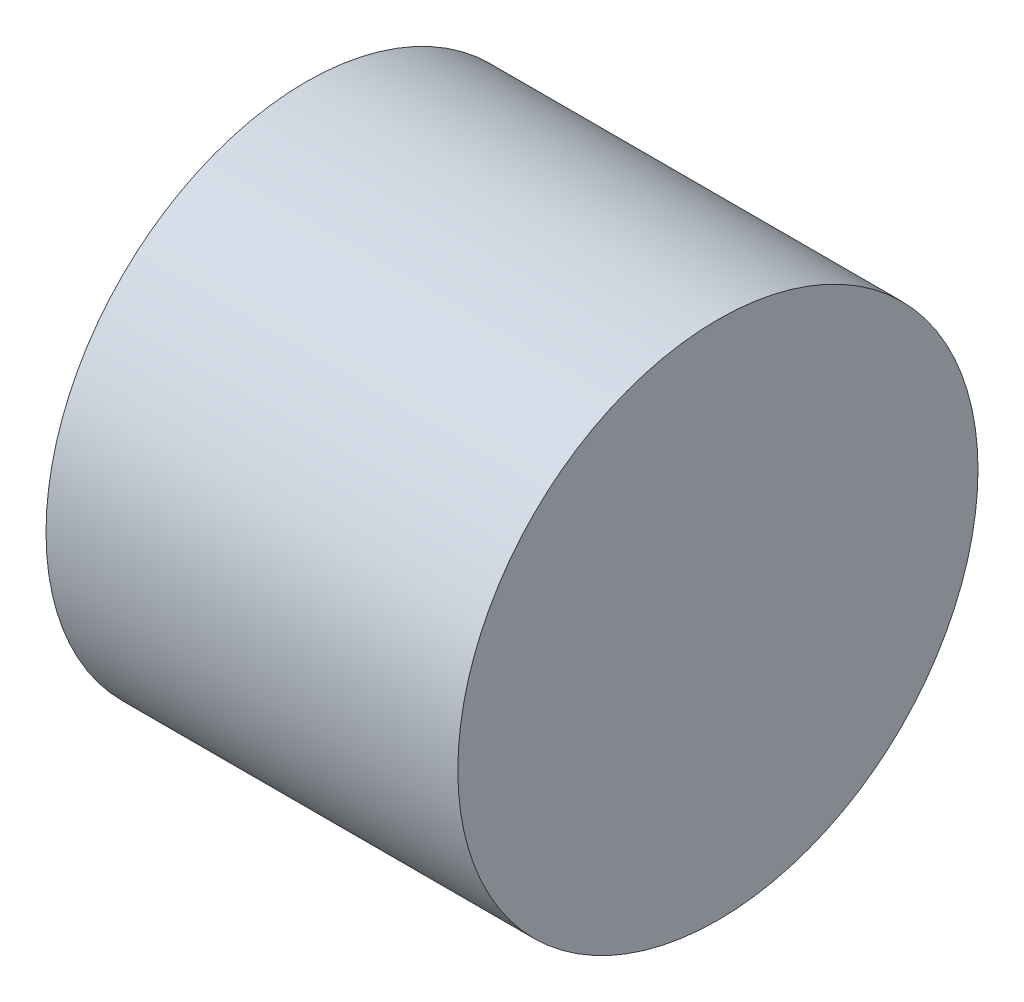
from build123d import *

# Parameters (mm, degrees)
BODY_SK1_R = 6
BODY_DEPTH = 9.5


with BuildPart() as part:
    # Body_Sk1 → Body (new body)
    with BuildSketch(Plane(origin=(47.4, 0, 0), x_dir=(0, 0, -1), z_dir=(1, 0, 0))):
        with Locations((22.5, -18)):
            Circle(BODY_SK1_R)
    extrude(amount=-BODY_DEPTH)


solid = part.part
